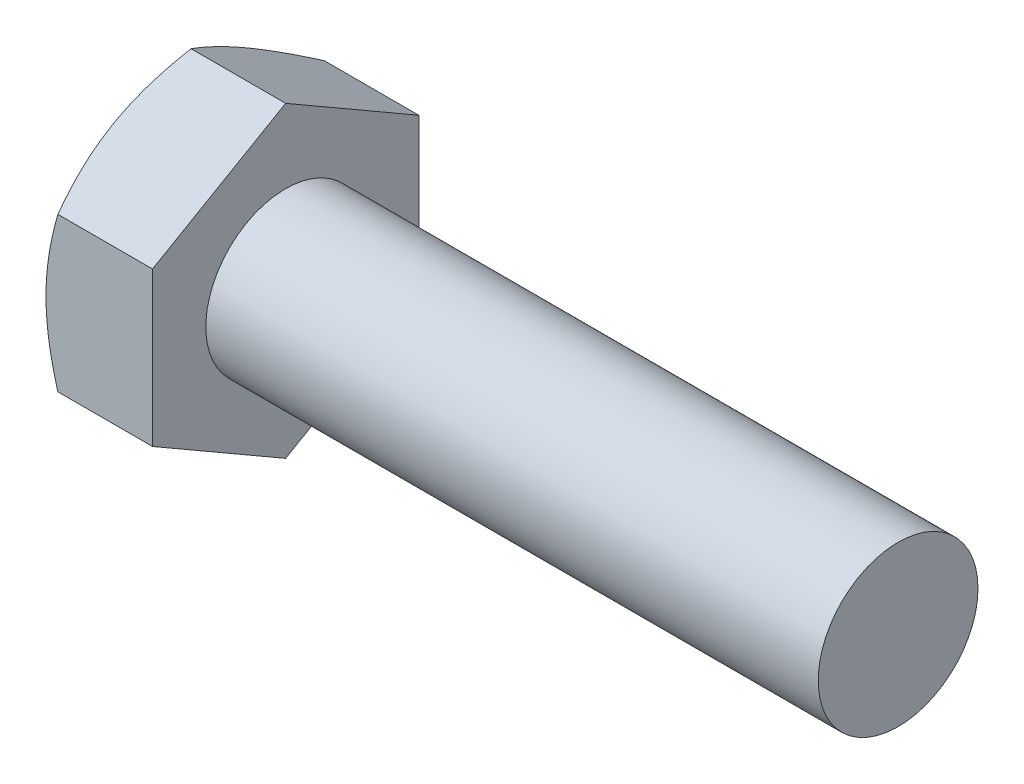
from build123d import *

# Parameters (mm, degrees)
SKETCH2_R           = 3
BOSS_EXTRUDE1_DEPTH = 30
CHAMFER1_SIZE       = 0.75
BOSS_EXTRUDE2_DEPTH = 4
SKETCH6_OUTSIDE_W   = 143.634
SKETCH6_OUTSIDE_H   = 145.182
SKETCH6_OUTSIDE_R   = 5
CUT_EXTRUDE1_DEPTH  = 35.847285882
CUT_EXTRUDE1_DRAFT  = -60
SKETCH7_W           = 0.197562976
SKETCH7_H           = 0.197562976
CUT_EXTRUDE2_DEPTH  = 0.25
SKETCH10_R          = 3.903205457
CUT_EXTRUDE3_DEPTH  = 7


with BuildPart() as part:
    # Sketch2 → Boss-Extrude1 (new body)
    with BuildSketch(Plane(origin=(17, 0, 0), x_dir=(0, 0, -1), z_dir=(1, 0, 0))):
        Circle(SKETCH2_R)
    extrude(amount=-BOSS_EXTRUDE1_DEPTH)

    # Chamfer1
    chamfer1_edges = [part.edges().sort_by_distance(p)[0] for p in [
        (17, 0, 3),
    ]]
    chamfer(chamfer1_edges, length=CHAMFER1_SIZE)

    # Sketch3 → Boss-Extrude2 (add)
    with BuildSketch(Plane.ZY.offset(13)):
        Polygon((-5, -2.886751346), (0, -5.773502692), (5, -2.886751346), (5, 2.886751346), (0, 5.773502692), (-5, 2.886751346), align=None)
    extrude(amount=BOSS_EXTRUDE2_DEPTH)


with BuildPart() as cut_extrude1_tool:
    # Sketch6 outside → Cut-Extrude1 (with draft: the straight prism first)
    with BuildSketch(Plane.ZY.offset(17)):
        Rectangle(SKETCH6_OUTSIDE_W, SKETCH6_OUTSIDE_H)
        Circle(SKETCH6_OUTSIDE_R, mode=Mode.SUBTRACT)
    extrude(amount=-CUT_EXTRUDE1_DEPTH)
    # Cut-Extrude1: the draft: its side faces are tilted about the plane it starts from
    cut_extrude1_sides = [cut_extrude1_tool.faces().sort_by_distance(p)[0] for p in [
        (0.923642941, -72.591, 0),
        (0.923642941, 0, 71.817),
        (0.923642941, 72.591, 0),
        (0.923642941, 0, -71.817),
        (0.923642941, 0, -5),
    ]]
    draft(cut_extrude1_sides, Plane.ZY.offset(17), CUT_EXTRUDE1_DRAFT)


with BuildPart() as part_1:
    add(part.part)

    # Cut-Extrude1: cut by cut_extrude1_tool
    add(cut_extrude1_tool.part, mode=Mode.SUBTRACT)

    # Sketch7 → Cut-Extrude2 (cut)
    # profile 1 of 4: a face of its own
    with BuildSketch(Plane.ZY.offset(17)):
        with BuildLine():
            Line((-1.284159342, 2.5), (-1.481722318, 2.5))
            Line((-1.481722318, 2.5), (-1.481722318, 3.700812462))
            add(Edge.make_bspline(
                [(-1.481722318, 3.700812462), (-1.493098012, 3.689842005), (-1.516741144, 3.667041113), (-1.556707362, 3.634772156), (-1.601314769, 3.602066201), (-1.649984109, 3.570615769), (-1.699594268, 3.541008578), (-1.7475361, 3.514381463), (-1.793009194, 3.491848462), (-1.822962567, 3.479527328), (-1.837335675, 3.47361504)],
                knots=[0, 0, 0, 0, 0.893362401, 1.856755847, 2.901947673, 4.020460078, 5.132200827, 6.168787962, 7.121294059, 8, 8, 8, 8], degree=3))
            Line((-1.837335675, 3.47361504), (-1.837335675, 3.655743408))
            add(Edge.make_bspline(
                [(-1.837335675, 3.655743408), (-1.812648378, 3.668457416), (-1.763991177, 3.693515971), (-1.695249075, 3.736795542), (-1.631070927, 3.783712378), (-1.572519137, 3.834256092), (-1.520031188, 3.885920841), (-1.475798832, 3.938052602), (-1.438788011, 3.98874045), (-1.42021898, 4.024089603), (-1.411340508, 4.040991211)],
                knots=[0, 0, 0, 0, 1.141258006, 2.249351951, 3.335817539, 4.406819942, 5.426913362, 6.360259544, 7.215985427, 8, 8, 8, 8], degree=3))
            Line((-1.411340508, 4.040991211), (-1.284159342, 4.040991211))
            Line((-1.284159342, 4.040991211), (-1.284159342, 2.5))
        make_face()
    # profile 2 of 4: a face of its own
    with BuildSketch(Plane.ZY.offset(17)):
        with BuildLine():
            add(Edge.make_bspline(
                [(-0.790251903, 3.260000072), (-0.790052858, 3.282022251), (-0.789663013, 3.325154426), (-0.787244933, 3.388264546), (-0.783023159, 3.448197614), (-0.776721214, 3.50490158), (-0.769258531, 3.558504437), (-0.759556995, 3.608929689), (-0.748641356, 3.656290471), (-0.735544549, 3.700537418), (-0.721155446, 3.742050974), (-0.704830549, 3.780764541), (-0.686462825, 3.816637074), (-0.666954934, 3.85004059), (-0.645279941, 3.880455529), (-0.622746104, 3.908735457), (-0.597715799, 3.933843239), (-0.57122984, 3.956424902), (-0.542898213, 3.976351902), (-0.512870822, 3.993546501), (-0.481263204, 4.008728091), (-0.447472952, 4.020156788), (-0.412201546, 4.029473599), (-0.375177484, 4.036327159), (-0.336359967, 4.040367563), (-0.309833651, 4.04078098), (-0.296344464, 4.040991211)],
                knots=[0, 0, 0, 0, 1.514747001, 2.966751498, 4.343369068, 5.64627492, 6.890416844, 8.064737671, 9.177176366, 10.232018008, 11.237056675, 12.19799043, 13.119080079, 14.007588942, 14.855863561, 15.685992447, 16.491747269, 17.290132607, 18.077525251, 18.870243746, 19.668095604, 20.485086593, 21.319398728, 22.175900658, 23.072407314, 24, 24, 24, 24], degree=3))
            add(Edge.make_bspline(
                [(-0.296344464, 4.040991211), (-0.276554072, 4.040409387), (-0.237675053, 4.039266372), (-0.180911485, 4.029944144), (-0.127415481, 4.013997036), (-0.077221797, 3.992483699), (-0.031188485, 3.965157621), (0.009921203, 3.93193861), (0.045663832, 3.893175459), (0.075649327, 3.848408838), (0.101859643, 3.798873708), (0.125144312, 3.744347738), (0.146192977, 3.68489203), (0.161129567, 3.631670872), (0.171783825, 3.585728479), (0.178836097, 3.547836494), (0.184690897, 3.506950828), (0.189176465, 3.463170395), (0.192856768, 3.416544299), (0.195698897, 3.36704351), (0.197141568, 3.314544309), (0.197419873, 3.278522328), (0.197562976, 3.260000072)],
                knots=[0, 0, 0, 0, 1.134486744, 2.228744715, 3.287356444, 4.328707449, 5.352829806, 6.347195599, 7.349461267, 8.364207941, 9.428085653, 10.559314403, 11.761222316, 13.04268526, 13.726896727, 14.465273606, 15.252205015, 16.094778733, 16.988606776, 17.934225168, 18.937792761, 20, 20, 20, 20], degree=3))
            add(Edge.make_bspline(
                [(0.197562976, 3.260000072), (0.197360203, 3.238081335), (0.196964045, 3.195258767), (0.194610758, 3.132654684), (0.190134593, 3.073173782), (0.184626591, 3.016679807), (0.176294137, 2.963323573), (0.167315467, 2.912878383), (0.156211069, 2.865573301), (0.143254845, 2.821387596), (0.128663193, 2.78008763), (0.11266119, 2.74136128), (0.094937435, 2.705235008), (0.074964401, 2.672061172), (0.053655947, 2.641399446), (0.03085601, 2.613134809), (0.006081205, 2.587674071), (-0.020643434, 2.565160142), (-0.048776137, 2.544879764), (-0.07887653, 2.527515404), (-0.110812868, 2.513129332), (-0.144371773, 2.500829956), (-0.179893749, 2.491817695), (-0.217098671, 2.484918949), (-0.256123623, 2.480856468), (-0.282752541, 2.480450776), (-0.296344464, 2.480243702)],
                knots=[0, 0, 0, 0, 1.508974709, 2.94807912, 4.311757619, 5.615040294, 6.854280449, 8.028314546, 9.141715822, 10.197470207, 11.196696834, 12.155719058, 13.080757287, 13.963948316, 14.818758719, 15.649605906, 16.461113142, 17.260189315, 18.052359509, 18.845763934, 19.647754795, 20.461145776, 21.303032214, 22.167241874, 23.064524267, 24, 24, 24, 24], degree=3))
            add(Edge.make_bspline(
                [(-0.296344464, 2.480243702), (-0.31416505, 2.480752036), (-0.348910289, 2.481743145), (-0.399653148, 2.488477126), (-0.447278028, 2.500329248), (-0.492186617, 2.516224614), (-0.533874131, 2.537485582), (-0.572539611, 2.563353701), (-0.608960011, 2.593227122), (-0.629925808, 2.616796566), (-0.64053621, 2.628724626)],
                knots=[0, 0, 0, 0, 1.10322584, 2.150986741, 3.161425019, 4.136713905, 5.093944212, 6.049774532, 7.013026876, 8, 8, 8, 8], degree=3))
            add(Edge.make_bspline(
                [(-0.64053621, 2.628724626), (-0.652749028, 2.646341795), (-0.677932381, 2.682669151), (-0.707407312, 2.744610663), (-0.733699472, 2.81279957), (-0.754333998, 2.888573732), (-0.770495975, 2.971330072), (-0.782168957, 3.061230974), (-0.788774716, 3.158237599), (-0.789748392, 3.225313505), (-0.790251903, 3.260000072)],
                knots=[0, 0, 0, 0, 0.779365345, 1.607084704, 2.489375761, 3.438383567, 4.461919411, 5.557722155, 6.737039282, 8, 8, 8, 8], degree=3))
        make_face()
        with BuildLine():
            add(Edge.make_bspline(
                [(-0.592688927, 3.260617457), (-0.592492763, 3.230978591), (-0.592117261, 3.174243246), (-0.588194178, 3.093187016), (-0.581440751, 3.020063233), (-0.57251228, 2.954973141), (-0.560723083, 2.897828693), (-0.545920352, 2.84877551), (-0.529234153, 2.807224843), (-0.508585298, 2.77369168), (-0.485977083, 2.746357261), (-0.462635646, 2.722848776), (-0.438011843, 2.702867102), (-0.412266343, 2.686206461), (-0.384999685, 2.673592119), (-0.356510025, 2.664449215), (-0.326791165, 2.659187614), (-0.30655127, 2.658431621), (-0.296344464, 2.658050381)],
                knots=[0, 0, 0, 0, 1.89448813, 3.626469325, 5.185477471, 6.587276848, 7.82441448, 8.910550357, 9.859733512, 10.6775885, 11.416198291, 12.123144072, 12.791880183, 13.439617036, 14.078171869, 14.70637855, 15.347637704, 16, 16, 16, 16], degree=3))
            add(Edge.make_bspline(
                [(-0.296344464, 2.658050381), (-0.286140213, 2.658439952), (-0.265905387, 2.659212463), (-0.236117858, 2.66435804), (-0.207739045, 2.673971614), (-0.180513042, 2.686541403), (-0.154580415, 2.702822298), (-0.130077548, 2.722879447), (-0.106613153, 2.746373973), (-0.084106493, 2.774026105), (-0.063614954, 2.807714303), (-0.046615742, 2.849231123), (-0.032043703, 2.898370213), (-0.020189817, 2.955485547), (-0.011224514, 3.020472726), (-0.00451192, 3.093393697), (-0.000562582, 3.174345633), (-0.000193277, 3.230978457), (0, 3.260617457)],
                knots=[0, 0, 0, 0, 0.652509534, 1.29391342, 1.924290653, 2.562989607, 3.207355802, 3.876242846, 4.583348185, 5.32723334, 6.150888545, 7.094226006, 8.186903555, 9.424320409, 10.81992305, 12.379283064, 14.105084285, 16, 16, 16, 16], degree=3))
            add(Edge.make_bspline(
                [(0, 3.260617457), (-0.000187089, 3.289639765), (-0.000545544, 3.345245408), (-0.00459674, 3.424740087), (-0.010945329, 3.496636517), (-0.01962919, 3.56100098), (-0.03117004, 3.6177636), (-0.045167517, 3.667045216), (-0.061847603, 3.708740728), (-0.081680166, 3.743268967), (-0.103757778, 3.77159149), (-0.126819935, 3.796107098), (-0.151443196, 3.816956825), (-0.178063809, 3.833682782), (-0.205823744, 3.847176663), (-0.235360851, 3.856463495), (-0.266384805, 3.862169035), (-0.287676143, 3.862842166), (-0.298505309, 3.863184533)],
                knots=[0, 0, 0, 0, 1.850066095, 3.544656626, 5.0727657, 6.45041401, 7.682899467, 8.762389858, 9.712573485, 10.538438529, 11.291566246, 11.996865408, 12.681389046, 13.341983376, 13.996294293, 14.643563182, 15.31009126, 16, 16, 16, 16], degree=3))
            add(Edge.make_bspline(
                [(-0.298505309, 3.863184533), (-0.308711474, 3.862916661), (-0.328836725, 3.862388453), (-0.358302727, 3.857346709), (-0.386227312, 3.84891579), (-0.412930404, 3.837495291), (-0.437745374, 3.822125556), (-0.461656324, 3.804180295), (-0.483543356, 3.782315999), (-0.49673229, 3.765970592), (-0.503476896, 3.757611818)],
                knots=[0, 0, 0, 0, 1.021318143, 2.013908504, 2.982026795, 3.937174072, 4.91255697, 5.897578595, 6.924855925, 8, 8, 8, 8], degree=3))
            add(Edge.make_bspline(
                [(-0.503476896, 3.757611818), (-0.510819714, 3.745335366), (-0.5263262, 3.719410087), (-0.543677057, 3.674350882), (-0.559004117, 3.622856788), (-0.57162337, 3.56413553), (-0.580752514, 3.49828784), (-0.58795962, 3.425390186), (-0.591703443, 3.345340795), (-0.592351369, 3.289637751), (-0.592688927, 3.260617457)],
                knots=[0, 0, 0, 0, 0.671104906, 1.417232262, 2.260109084, 3.195198885, 4.23592645, 5.382417421, 6.636286093, 8, 8, 8, 8], degree=3))
        make_face(mode=Mode.SUBTRACT)
    # profile 3 of 4: a face of its own
    with BuildSketch(Plane.ZY.offset(17)):
        with Locations((0.592688927, 2.598781488)):
            Rectangle(SKETCH7_W, SKETCH7_H)
    # profile 4 of 4: a face of its own
    with BuildSketch(Plane.ZY.offset(17)):
        with BuildLine():
            Line((1.007571176, 2.875369654), (1.205134152, 2.895125952))
            add(Edge.make_bspline(
                [(1.205134152, 2.895125952), (1.206920239, 2.885003602), (1.210372897, 2.865436243), (1.218164458, 2.837549402), (1.226067012, 2.811547623), (1.236268145, 2.788010165), (1.246891881, 2.766297683), (1.258922971, 2.746627755), (1.272575767, 2.729395444), (1.291855309, 2.709202247), (1.319210172, 2.688130304), (1.357127719, 2.671061208), (1.398840582, 2.65958445), (1.428236664, 2.658573426), (1.443444492, 2.658050381)],
                knots=[0, 0, 0, 0, 0.994516507, 1.922484754, 2.80151264, 3.623050913, 4.402748861, 5.140924173, 5.850441436, 6.526872911, 7.841975818, 9.161260782, 10.53140107, 12, 12, 12, 12], degree=3))
            add(Edge.make_bspline(
                [(1.443444492, 2.658050381), (1.456751488, 2.658529578), (1.482941721, 2.659472712), (1.521127946, 2.666783962), (1.557442454, 2.678496432), (1.591253108, 2.695301374), (1.622436856, 2.71575252), (1.649674808, 2.7400526), (1.673330676, 2.767155041), (1.692759492, 2.798382253), (1.709342511, 2.83404897), (1.725011258, 2.8746088), (1.739833634, 2.920760517), (1.753006889, 2.971915473), (1.764802895, 3.026206092), (1.773081217, 3.082402208), (1.778174547, 3.13941128), (1.778719417, 3.177774463), (1.778992858, 3.197026874)],
                knots=[0, 0, 0, 0, 0.897794352, 1.766998465, 2.614902619, 3.466100941, 4.308008728, 5.124841802, 5.922729683, 6.728261092, 7.598214292, 8.574707161, 9.662086263, 10.868425066, 12.139522319, 13.41071447, 14.70057738, 16, 16, 16, 16], degree=3))
            add(Edge.make_bspline(
                [(1.778992858, 3.197026874), (1.778899344, 3.202274865), (1.778675616, 3.214830375), (1.778290769, 3.227382036), (1.778066782, 3.234687316)],
                knots=[0, 0, 0, 0, 0.835966126, 2, 2, 2, 2], degree=3))
            add(Edge.make_bspline(
                [(1.778066782, 3.234687316), (1.768542584, 3.22022413), (1.749509536, 3.191321063), (1.714445959, 3.152529649), (1.674332612, 3.118121138), (1.629778386, 3.088362715), (1.58188343, 3.063940569), (1.531480967, 3.046194448), (1.479005485, 3.035236452), (1.443291513, 3.034030076), (1.425231655, 3.033420035)],
                knots=[0, 0, 0, 0, 0.978840568, 1.956103883, 2.947027447, 3.962820877, 4.980997961, 5.980964245, 6.979013046, 8, 8, 8, 8], degree=3))
            add(Edge.make_bspline(
                [(1.425231655, 3.033420035), (1.410181713, 3.033809962), (1.380555612, 3.034577542), (1.337158587, 3.041399547), (1.295419155, 3.051630137), (1.255732843, 3.067119745), (1.21748219, 3.086276405), (1.181068826, 3.109789736), (1.146436643, 3.137627733), (1.114033143, 3.169443767), (1.084462099, 3.2049069), (1.05838385, 3.243153184), (1.036728508, 3.28436963), (1.018710514, 3.328041798), (1.004807734, 3.374591649), (0.995147123, 3.423910112), (0.988649898, 3.475808926), (0.98809691, 3.511357846), (0.987814879, 3.529488319)],
                knots=[0, 0, 0, 0, 0.975490236, 1.920271282, 2.842894855, 3.757591483, 4.67685385, 5.613562631, 6.563069669, 7.554119451, 8.55387214, 9.553424333, 10.550567425, 11.568071726, 12.613215376, 13.695622473, 14.824733476, 16, 16, 16, 16], degree=3))
            add(Edge.make_bspline(
                [(0.987814879, 3.529488319), (0.988237289, 3.548232953), (0.989063596, 3.584900708), (0.995305351, 3.63851352), (1.005631769, 3.689304987), (1.020691426, 3.737178163), (1.039315186, 3.782440645), (1.062799025, 3.824766099), (1.090238676, 3.864335583), (1.12179809, 3.900767612), (1.1564816, 3.933457226), (1.193305446, 3.962633275), (1.232749472, 3.986615849), (1.274057373, 4.006611333), (1.317541757, 4.022064144), (1.363128302, 4.033233279), (1.410943155, 4.039786979), (1.443527149, 4.040584988), (1.460113868, 4.040991211)],
                knots=[0, 0, 0, 0, 1.151671969, 2.252870106, 3.311924673, 4.331900944, 5.332425074, 6.314476151, 7.300265758, 8.286521684, 9.270545387, 10.225535917, 11.167946231, 12.101233205, 13.04124339, 13.998220545, 14.981004193, 16, 16, 16, 16], degree=3))
            add(Edge.make_bspline(
                [(1.460113868, 4.040991211), (1.472160605, 4.04074757), (1.49610549, 4.040263292), (1.53174045, 4.036565994), (1.56653158, 4.029901008), (1.600705712, 4.021487923), (1.633686425, 4.009809927), (1.666109474, 3.996305519), (1.697583789, 3.979788608), (1.728292766, 3.961006809), (1.758043531, 3.940290273), (1.78541595, 3.916489215), (1.811504082, 3.891230711), (1.835777069, 3.863722031), (1.857467159, 3.833538628), (1.878046883, 3.801747632), (1.896524197, 3.767655353), (1.913374225, 3.731215619), (1.928371403, 3.691678329), (1.940882807, 3.648169752), (1.951607872, 3.600539191), (1.960537546, 3.548723511), (1.967159045, 3.492759655), (1.972032081, 3.432730793), (1.975222249, 3.368591267), (1.975491252, 3.324417814), (1.975629758, 3.301673513)],
                knots=[0, 0, 0, 0, 0.850689348, 1.69088598, 2.526071361, 3.350886897, 4.173587108, 4.994166539, 5.82944675, 6.680632524, 7.535501428, 8.385942454, 9.238956306, 10.098905971, 10.972410977, 11.861345628, 12.77184846, 13.708225841, 14.694799433, 15.754852217, 16.902446579, 18.141290626, 19.466225842, 20.880733292, 22.39393263, 24, 24, 24, 24], degree=3))
            add(Edge.make_bspline(
                [(1.975629758, 3.301673513), (1.975490325, 3.277900399), (1.975218576, 3.231567557), (1.972003363, 3.163933366), (1.967132776, 3.099998865), (1.960506598, 3.039722069), (1.951514674, 2.983194972), (1.940827057, 2.930427456), (1.928222834, 2.881322105), (1.913411036, 2.835874606), (1.896572884, 2.793562676), (1.878123243, 2.753865304), (1.857460667, 2.716841197), (1.834817321, 2.682419349), (1.81048396, 2.650539597), (1.784080657, 2.621287341), (1.755598839, 2.594751007), (1.725401557, 2.570631953), (1.69353413, 2.54937701), (1.660430384, 2.530622167), (1.625716723, 2.515258667), (1.589750014, 2.502655004), (1.552594169, 2.492248635), (1.513946549, 2.485236805), (1.473985704, 2.481265544), (1.446951668, 2.480587277), (1.433257651, 2.480243702)],
                knots=[0, 0, 0, 0, 1.538356107, 2.998194159, 4.380716326, 5.687456969, 6.921258146, 8.08355215, 9.170518603, 10.200253214, 11.174652363, 12.115998813, 13.031191965, 13.915860606, 14.780247615, 15.624154577, 16.462764255, 17.29681422, 18.1223677, 18.939254916, 19.756006416, 20.575278551, 21.404021733, 22.250368457, 23.113728878, 24, 24, 24, 24], degree=3))
            add(Edge.make_bspline(
                [(1.433257651, 2.480243702), (1.418732748, 2.480494839), (1.390314716, 2.480986189), (1.348827314, 2.486152771), (1.309305056, 2.494007659), (1.271862965, 2.505603334), (1.236220636, 2.519877298), (1.202986414, 2.538118612), (1.171569683, 2.559163632), (1.142358031, 2.583436747), (1.115693486, 2.610848821), (1.091567168, 2.640724272), (1.070415495, 2.673450039), (1.052349162, 2.70883318), (1.036346581, 2.746576015), (1.023940229, 2.787184652), (1.013861262, 2.83028456), (1.00970173, 2.860098607), (1.007571176, 2.875369654)],
                knots=[0, 0, 0, 0, 1.08199657, 2.11693069, 3.111083497, 4.081436044, 5.034173265, 5.967546613, 6.901297947, 7.84883568, 8.792454994, 9.747011506, 10.706361727, 11.690764787, 12.70483191, 13.757514363, 14.851376857, 16, 16, 16, 16], degree=3))
        make_face()
        with BuildLine():
            add(Edge.make_bspline(
                [(1.778066782, 3.533810009), (1.777844584, 3.546167498), (1.777412091, 3.570220558), (1.773622923, 3.605313673), (1.767526176, 3.638360963), (1.758968941, 3.669552455), (1.747347963, 3.698557507), (1.733885852, 3.72605331), (1.717423045, 3.751277762), (1.698847657, 3.774570528), (1.678386493, 3.79540537), (1.656104474, 3.813571489), (1.632419371, 3.829143971), (1.606762975, 3.84138813), (1.579978695, 3.851477273), (1.551423134, 3.858071145), (1.521489215, 3.862690284), (1.500880058, 3.863017562), (1.490365698, 3.863184533)],
                knots=[0, 0, 0, 0, 1.20361398, 2.342757417, 3.433960756, 4.474970456, 5.487648377, 6.473933575, 7.452701285, 8.415527761, 9.372491588, 10.291530068, 11.211879743, 12.12647906, 13.055739058, 13.994253148, 14.97671008, 16, 16, 16, 16], degree=3))
            add(Edge.make_bspline(
                [(1.490365698, 3.863184533), (1.479550713, 3.862856809), (1.458245164, 3.862211193), (1.427017644, 3.858053397), (1.397402188, 3.850092498), (1.36919886, 3.839532546), (1.342094419, 3.826470071), (1.317074221, 3.809354236), (1.29309033, 3.789957753), (1.271104705, 3.76745525), (1.251021561, 3.742783687), (1.233326098, 3.716174633), (1.218424276, 3.687615052), (1.206512128, 3.657224018), (1.19677715, 3.625266419), (1.190089912, 3.591456506), (1.18597516, 3.555830273), (1.185579924, 3.531454958), (1.185377855, 3.518992786)],
                knots=[0, 0, 0, 0, 1.007165334, 1.984118292, 2.925321257, 3.856078893, 4.785899085, 5.718627206, 6.671847665, 7.654235469, 8.641842333, 9.630378272, 10.624608936, 11.635186472, 12.665777387, 13.731187195, 14.840042241, 16, 16, 16, 16], degree=3))
            add(Edge.make_bspline(
                [(1.185377855, 3.518992786), (1.185564481, 3.50786364), (1.185930382, 3.48604371), (1.190287864, 3.454199511), (1.196100099, 3.423807131), (1.2053659, 3.395176801), (1.216528497, 3.367892863), (1.231036441, 3.342581934), (1.247371005, 3.318487167), (1.266510109, 3.29641574), (1.287668429, 3.276393087), (1.31077761, 3.258941189), (1.335545758, 3.244002062), (1.36220298, 3.231978182), (1.390589415, 3.222718025), (1.420641701, 3.215900682), (1.452490468, 3.211840104), (1.474301842, 3.211433897), (1.485426624, 3.211226713)],
                knots=[0, 0, 0, 0, 1.102204012, 2.160993585, 3.181057555, 4.164839289, 5.138418409, 6.097303793, 7.050641095, 8.019669129, 8.986440483, 9.932879371, 10.884360123, 11.847412593, 12.824617322, 13.839006415, 14.897795988, 16, 16, 16, 16], degree=3))
            add(Edge.make_bspline(
                [(1.485426624, 3.211226713), (1.495831895, 3.211435921), (1.516311795, 3.211847691), (1.546312698, 3.215925579), (1.574819195, 3.222755565), (1.601959278, 3.232041219), (1.627688956, 3.244060942), (1.651835213, 3.259118787), (1.674864814, 3.276371256), (1.696102673, 3.296529924), (1.715513299, 3.318849511), (1.732299881, 3.343550515), (1.746634721, 3.37018436), (1.7579177, 3.399066744), (1.76695483, 3.429842075), (1.773317571, 3.462705196), (1.777484418, 3.497585953), (1.777869725, 3.521552704), (1.778066782, 3.533810009)],
                knots=[0, 0, 0, 0, 1.017004716, 2.00169281, 2.953445817, 3.879374072, 4.80207141, 5.723561102, 6.657273834, 7.611045633, 8.581233951, 9.544037932, 10.525327521, 11.53237926, 12.57032081, 13.657564536, 14.802009319, 16, 16, 16, 16], degree=3))
        make_face(mode=Mode.SUBTRACT)
    extrude(amount=-CUT_EXTRUDE2_DEPTH, mode=Mode.SUBTRACT)

    # Sketch9 → Revolve1 (revolve)
    with BuildSketch(Plane.XY):
        Polygon((-13, 3), (-13, 0), (2, 0), (-1, 3), align=None)
    revolve(axis=Axis((-13, 0, 0), (1, 0, 0)))

    # Sketch10 → Cut-Extrude3 (cut)
    with BuildSketch(Plane(origin=(17, 0, 0), x_dir=(0, 0, -1), z_dir=(1, 0, 0))):
        Circle(SKETCH10_R)
    extrude(amount=-CUT_EXTRUDE3_DEPTH, mode=Mode.SUBTRACT)


solid = part_1.part
